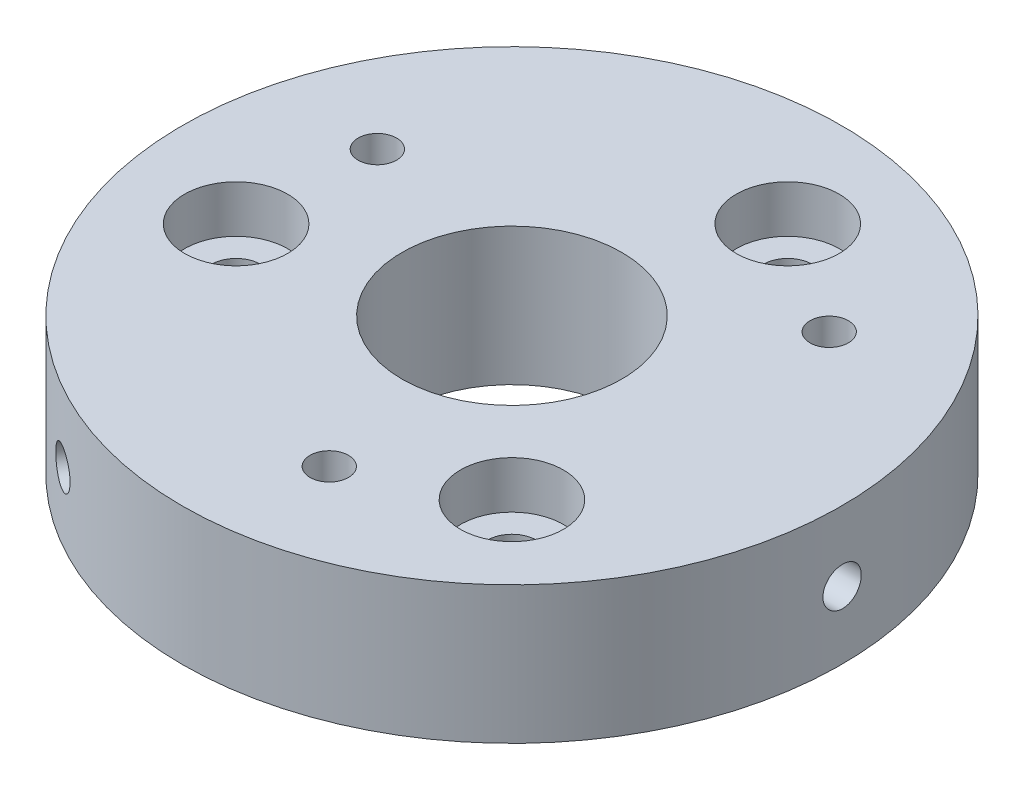
from build123d import *

# Parameters (mm, degrees)
SKETCH1_R                                      = 15.24
BOSS_EXTRUDE1_DEPTH                            = 6.35
CBORE_FOR_2_SOCKET_HEAD_CAP_SCREW1_D           = 2.2606
CBORE_FOR_2_SOCKET_HEAD_CAP_SCREW1_CBORE_D     = 4.7625
CBORE_FOR_2_SOCKET_HEAD_CAP_SCREW1_CBORE_DEPTH = 2.1844
CIRPATTERN1_COUNT                              = 3
CIRPATTERN2_COUNT                              = 3
CIRPATTERN3_COUNT                              = 3
SKETCH16_R                                     = 5.08
CUT_EXTRUDE1_DEPTH                             = 6.35


with BuildPart() as part:
    # Sketch1 → Boss-Extrude1 (new body)
    with BuildSketch(Plane(origin=(0, 0, 0), x_dir=(1, 0, 0), z_dir=(0, 1, 0))):
        with Locations(Location((0, 0, 0), (0, 0, 270))):
            Circle(SKETCH1_R)
    extrude(amount=BOSS_EXTRUDE1_DEPTH)

    # CBORE for #2 Socket Head Cap Screw1 (through all)
    with Locations(Plane(origin=(0, 6.35, 0), x_dir=(1, 0, 0), z_dir=(0, 1, 0))):
        with Locations((7.363810019, -7.363810019)):
            cbore_for_2_socket_head_cap_screw1 = CounterBoreHole(CBORE_FOR_2_SOCKET_HEAD_CAP_SCREW1_D / 2, CBORE_FOR_2_SOCKET_HEAD_CAP_SCREW1_CBORE_D / 2, CBORE_FOR_2_SOCKET_HEAD_CAP_SCREW1_CBORE_DEPTH)

    # CirPattern1: CBORE for #2 Socket Head Cap Screw1 ×3 about axis
    cirpattern1_axis = Axis((0, 0, 0), (0, 1, 0))
    for i in range(1, CIRPATTERN1_COUNT):
        add(cbore_for_2_socket_head_cap_screw1.rotate(cirpattern1_axis, i * 360 / CIRPATTERN1_COUNT), mode=Mode.SUBTRACT)

    # Sketch10 → Tap Drill for #2-56 Tap2 (revolve, cut)
    with BuildSketch(Plane(origin=(7.977586831, 6.35, -6.693990167), x_dir=(0, 0, 1), z_dir=(1, 0, 0))):
        Polygon((0, 0), (0, 4.59816509), (0.889, 4.064), (0.889, 0), align=None)
    tap_drill_for_2_56_tap2 = revolve(axis=Axis((7.977586831, 12.7, -6.693990167), (0, -1, 0)), mode=Mode.SUBTRACT)

    # CirPattern2: Tap Drill for #2-56 Tap2 ×3 about axis
    cirpattern2_axis = Axis((0, 0, 0), (0, 1, 0))
    for i in range(1, CIRPATTERN2_COUNT):
        add(tap_drill_for_2_56_tap2.rotate(cirpattern2_axis, i * 360 / CIRPATTERN2_COUNT), mode=Mode.SUBTRACT)

    # Sketch15 → Tap Drill for #2-56 Tap1 (revolve, cut)
    with BuildSketch(Plane(origin=(-7.57363795, 3.105629072, 13.224885943), x_dir=(0.8677746681735182, 0, 0.49695787072581954), z_dir=(0, 1, 0))):
        Polygon((0, 0), (0, 7.095959572), (0.889, 6.35), (0.889, 0), align=None)
    tap_drill_for_2_56_tap1 = revolve(axis=Axis((-10.729320429, 3.105629072, 18.735255086), (0.4969578707258196, 0, -0.8677746681735182)), mode=Mode.SUBTRACT)

    # CirPattern3: Tap Drill for #2-56 Tap1 ×3 about axis
    cirpattern3_axis = Axis((0, 6.35, 0), (0, -1, 0))
    for i in range(1, CIRPATTERN3_COUNT):
        add(tap_drill_for_2_56_tap1.rotate(cirpattern3_axis, i * 360 / CIRPATTERN3_COUNT), mode=Mode.SUBTRACT)

    # Sketch16 → Cut-Extrude1 (cut)
    with BuildSketch(Plane(origin=(0, 6.35, 0), x_dir=(1, 0, 0), z_dir=(0, 1, 0))):
        with Locations(Location((0, 0, 0), (0, 0, 270))):
            Circle(SKETCH16_R)
    extrude(amount=-CUT_EXTRUDE1_DEPTH, mode=Mode.SUBTRACT)


solid = part.part
